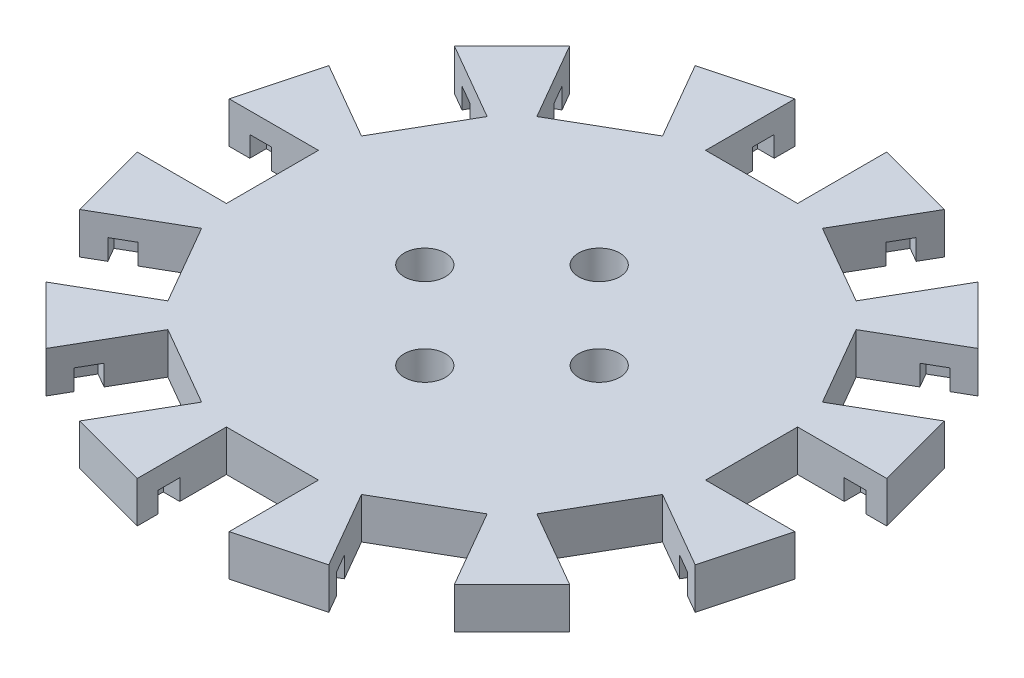
from build123d import *

# Parameters (mm, degrees)
BOSS_EXTRUDE1_DEPTH = 3
CUT_EXTRUDE1_DEPTH  = 3
SKETCH4_W           = 9.1
SKETCH4_H           = 1.6
SKETCH4_W_2         = 1.6
SKETCH4_H_2         = 9.1
CUT_EXTRUDE2_DEPTH  = 1.5
SKETCH7_R           = 1.5
CUT_EXTRUDE4_DEPTH  = 3


with BuildPart() as part:
    # Sketch2 → Boss-Extrude1 (new body)
    with BuildSketch(Plane(origin=(0, 0, 0), x_dir=(1, 0, 0), z_dir=(0, 1, 0))):
        Polygon((0, 24.84662833), (-12.423314165, 21.517811332), (-21.517811332, 12.423314165), (-24.84662833, 0), (-21.517811332, -12.423314165), (-12.423314165, -21.517811332), (0, -24.84662833), (12.423314165, -21.517811332), (21.517811332, -12.423314165), (24.84662833, 0), (21.517811332, 12.423314165), (12.423314165, 21.517811332), align=None)
    extrude(amount=BOSS_EXTRUDE1_DEPTH)

    # Sketch3 → Cut-Extrude1 (cut)
    with BuildSketch(Plane(origin=(0, 3, 0), x_dir=(1, 0, 0), z_dir=(0, 1, 0))):
        Polygon((-3.35, 23.948998535), (0, 24.84662833), (3.35, 23.948998535), (3.35, 17.448998535), (-3.35, 17.448998535), align=None)
        Polygon((5.823314165, 16.786276002), (9.073314165, 22.415441127), (12.423314165, 21.517811332), (14.87568437, 19.065441127), (11.62568437, 13.436276002), align=None)
        Polygon((13.436276002, 11.62568437), (19.065441127, 14.87568437), (21.517811332, 12.423314165), (22.415441127, 9.073314165), (16.786276002, 5.823314165), align=None)
        Polygon((17.448998535, 3.35), (23.948998535, 3.35), (24.84662833, 0), (23.948998535, -3.35), (17.448998535, -3.35), align=None)
        Polygon((16.786276002, -5.823314165), (22.415441127, -9.073314165), (21.517811332, -12.423314165), (19.065441127, -14.87568437), (13.436276002, -11.62568437), align=None)
        Polygon((11.62568437, -13.436276002), (14.87568437, -19.065441127), (12.423314165, -21.517811332), (9.073314165, -22.415441127), (5.823314165, -16.786276002), align=None)
        Polygon((3.35, -17.448998535), (3.35, -23.948998535), (0, -24.84662833), (-3.35, -23.948998535), (-3.35, -17.448998535), align=None)
        Polygon((-5.823314165, -16.786276002), (-9.073314165, -22.415441127), (-12.423314165, -21.517811332), (-14.87568437, -19.065441127), (-11.62568437, -13.436276002), align=None)
        Polygon((-13.436276002, -11.62568437), (-19.065441127, -14.87568437), (-21.517811332, -12.423314165), (-22.415441127, -9.073314165), (-16.786276002, -5.823314165), align=None)
        Polygon((-17.448998535, -3.35), (-23.948998535, -3.35), (-24.84662833, 0), (-23.948998535, 3.35), (-17.448998535, 3.35), align=None)
        Polygon((-16.786276002, 5.823314165), (-22.415441127, 9.073314165), (-21.517811332, 12.423314165), (-19.065441127, 14.87568437), (-13.436276002, 11.62568437), align=None)
        Polygon((-11.62568437, 13.436276002), (-14.87568437, 19.065441127), (-12.423314165, 21.517811332), (-9.073314165, 22.415441127), (-5.823314165, 16.786276002), align=None)
    extrude(amount=-CUT_EXTRUDE1_DEPTH, mode=Mode.SUBTRACT)

    # Sketch4 → Cut-Extrude2 (cut)
    with BuildSketch(Plane(origin=(0, 0, 0), x_dir=(-1, 0, 0), z_dir=(0, -1, 0))):
        with Locations((0, -21.648998535)):
            Rectangle(SKETCH4_W, SKETCH4_H)
        Polygon((-6.48408368, -20.330762375), (-7.28408368, -21.716403021), (-15.164914855, -17.166403021), (-14.364914855, -15.780762375), align=None)
        Polygon((-15.780762375, -14.364914855), (-17.166403021, -15.164914855), (-21.716403021, -7.28408368), (-20.330762375, -6.48408368), align=None)
        with Locations((-21.648998535, 0)):
            Rectangle(SKETCH4_W_2, SKETCH4_H_2)
        Polygon((-20.330762375, 6.48408368), (-21.716403021, 7.28408368), (-17.166403021, 15.164914855), (-15.780762375, 14.364914855), align=None)
        Polygon((-14.364914855, 15.780762375), (-15.164914855, 17.166403021), (-7.28408368, 21.716403021), (-6.48408368, 20.330762375), align=None)
        with Locations((0, 21.648998535)):
            Rectangle(SKETCH4_W, SKETCH4_H)
        Polygon((6.48408368, 20.330762375), (7.28408368, 21.716403021), (15.164914855, 17.166403021), (14.364914855, 15.780762375), align=None)
        Polygon((15.780762375, 14.364914855), (17.166403021, 15.164914855), (21.716403021, 7.28408368), (20.330762375, 6.48408368), align=None)
        with Locations((21.648998535, 0)):
            Rectangle(SKETCH4_W_2, SKETCH4_H_2)
        Polygon((20.330762375, -6.48408368), (21.716403021, -7.28408368), (17.166403021, -15.164914855), (15.780762375, -14.364914855), align=None)
        Polygon((14.364914855, -15.780762375), (15.164914855, -17.166403021), (7.28408368, -21.716403021), (6.48408368, -20.330762375), align=None)
    extrude(amount=-CUT_EXTRUDE2_DEPTH, mode=Mode.SUBTRACT)

    # Sketch7 → Cut-Extrude4 (cut)
    with BuildSketch(Plane.XZ):
        with Locations(Location((0, 6.35, 0), (0, 0, 270))):
            Circle(SKETCH7_R)
        with Locations(Location((6.35, 0, 0), (0, 0, 270))):
            Circle(SKETCH7_R)
        with Locations(Location((0, -6.35, 0), (0, 0, 270))):
            Circle(SKETCH7_R)
        with Locations(Location((-6.35, 0, 0), (0, 0, 270))):
            Circle(SKETCH7_R)
    extrude(amount=-CUT_EXTRUDE4_DEPTH, mode=Mode.SUBTRACT)


solid = part.part
